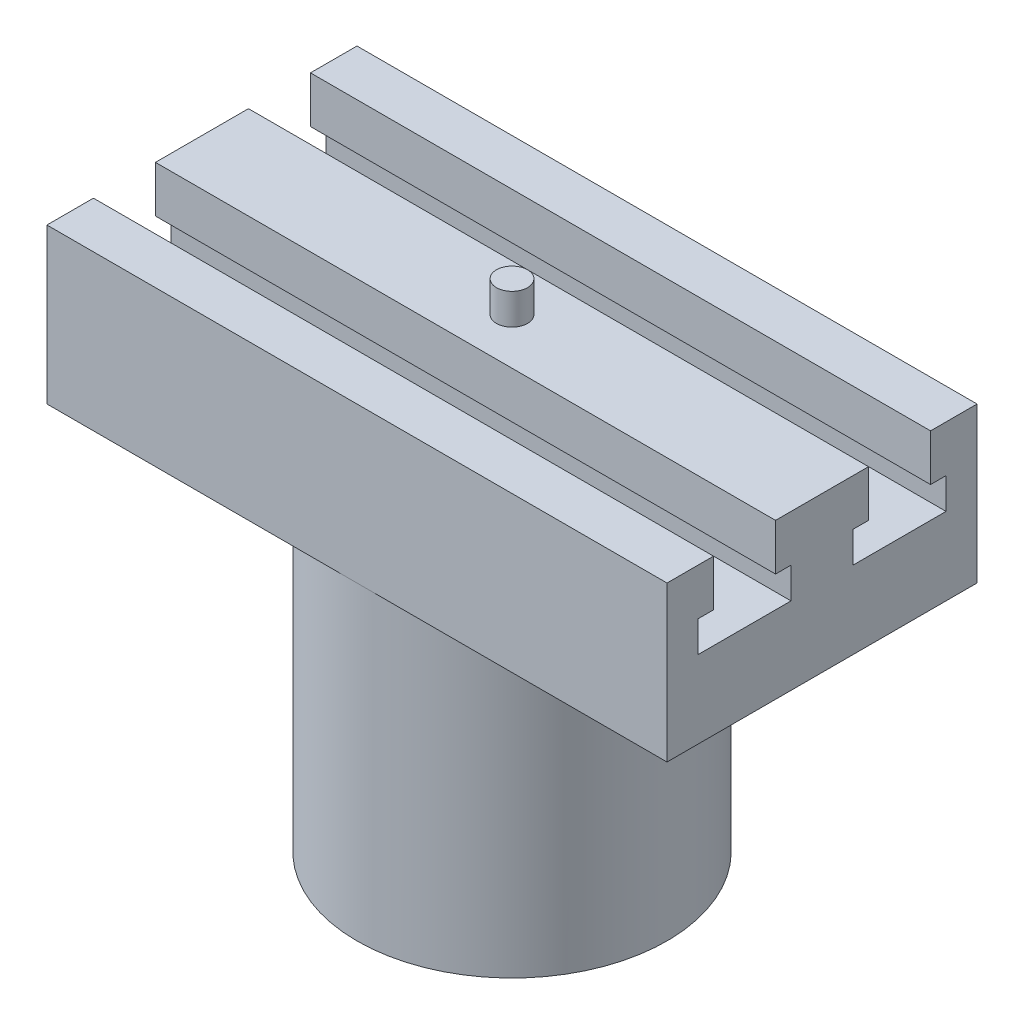
from build123d import *

# Parameters (mm, degrees)
SKETCH2_R           = 50
BOSS_EXTRUDE1_DEPTH = 100
SKETCH3_W           = 200
SKETCH3_H           = 100
BOSS_EXTRUDE2_DEPTH = 50
CUT_EXTRUDE1_DEPTH  = 255.95097568
SKETCH5_R           = 5
BOSS_EXTRUDE3_DEPTH = 10


with BuildPart() as part:
    # Sketch2 → Boss-Extrude1 (new body)
    with BuildSketch(Plane(origin=(0, 0, 0), x_dir=(1, 0, 0), z_dir=(0, 1, 0))):
        with Locations(Location((0, 0, 0), (0, 0, 270))):
            Circle(SKETCH2_R)
    extrude(amount=BOSS_EXTRUDE1_DEPTH)

    # Sketch3 → Boss-Extrude2 (add)
    with BuildSketch(Plane(origin=(0, 100, 0), x_dir=(1, 0, 0), z_dir=(0, 1, 0))):
        Rectangle(SKETCH3_W, SKETCH3_H)
    extrude(amount=BOSS_EXTRUDE2_DEPTH)

    # Sketch4 → Cut-Extrude1 (cut, through all)
    with BuildSketch(Plane(origin=(100, 0, 0), x_dir=(0, 0, -1), z_dir=(1, 0, 0))):
        Polygon((-35, 150), (-35, 135), (-40, 135), (-40, 125), (-10, 125), (-10, 135), (-15, 135), (-15, 150), align=None)
        Polygon((40, 135), (40, 125), (10, 125), (10, 135), (15, 135), (15, 150), (35, 150), (35, 135), align=None)
    extrude(amount=-CUT_EXTRUDE1_DEPTH, mode=Mode.SUBTRACT)

    # Sketch5 → Boss-Extrude3 (add)
    with BuildSketch(Plane(origin=(0, 150, 0), x_dir=(1, 0, 0), z_dir=(0, 1, 0))):
        with Locations(Location((0, 0, 0), (0, 0, 270))):
            Circle(SKETCH5_R)
    extrude(amount=BOSS_EXTRUDE3_DEPTH)


solid = part.part
